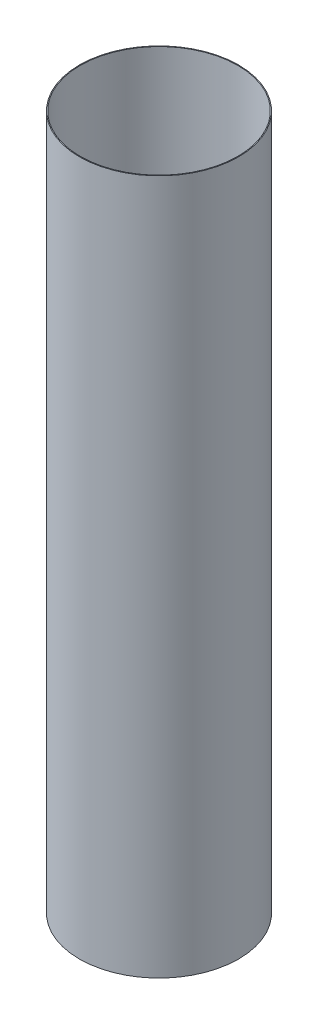
from build123d import *

# Parameters (mm, degrees)
SKETCH1_R           = 38.1
SKETCH1_R_2         = 37.72154
BOSS_EXTRUDE1_DEPTH = 332.6


with BuildPart() as part:
    # Sketch1 → Boss-Extrude1 (new body)
    with BuildSketch(Plane(origin=(0, 0, 0), x_dir=(1, 0, 0), z_dir=(0, 1, 0))):
        with Locations(Location((0, 0, 0), (0, 0, 270))):
            Circle(SKETCH1_R)
        with Locations(Location((0, 0, 0), (0, 0, 270))):
            Circle(SKETCH1_R_2, mode=Mode.SUBTRACT)
    extrude(amount=BOSS_EXTRUDE1_DEPTH)


solid = part.part
